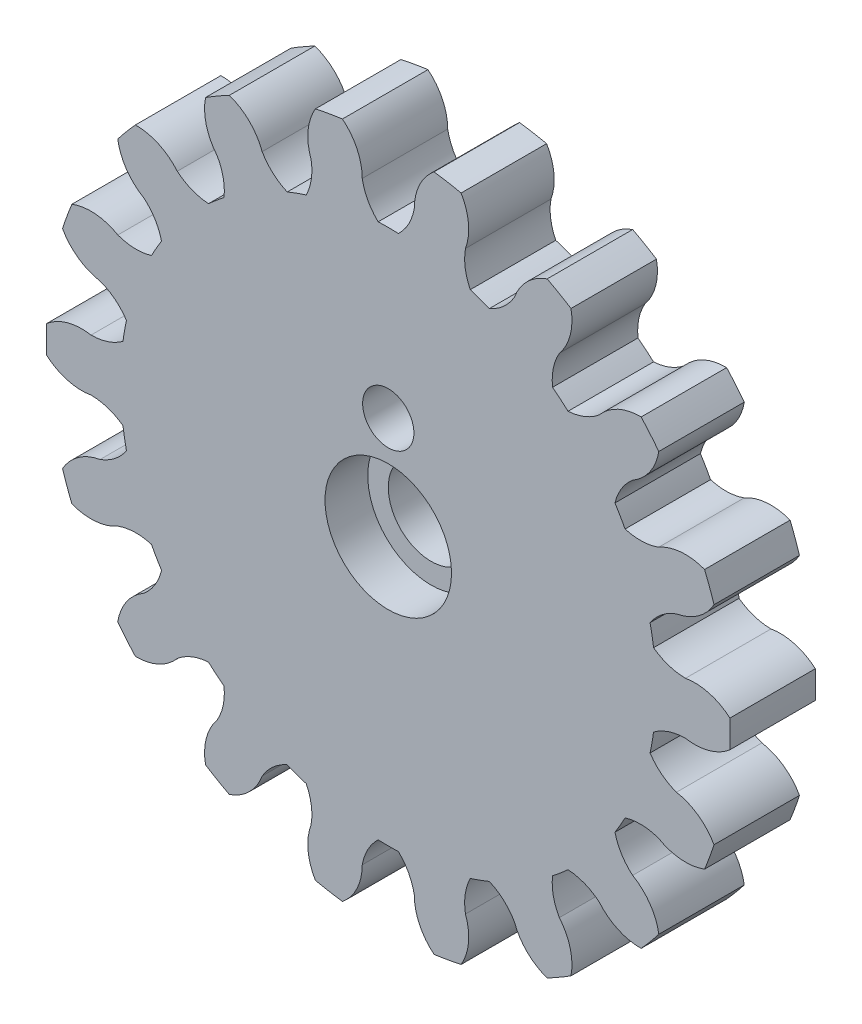
from build123d import *

# Parameters (mm, degrees)
CROQUIS1_R              = 20
CROQUIS1_R_2            = 2.5
CROQUIS1_R_3            = 1.5
SALIENTE_EXTRUIR1_DEPTH = 5
CORTAR_EXTRUIR1_DEPTH   = 29.722813233
MATRIZC1_COUNT          = 18
CROQUIS3_R              = 3.7
CORTAR_EXTRUIR2_DEPTH   = 2.5
CROQUIS4_R              = 2.25
CORTAR_EXTRUIR3_DEPTH   = 2.5


with BuildPart() as part:
    # Croquis1 → Saliente-Extruir1 (new body)
    with BuildSketch(Plane.XY):
        Circle(CROQUIS1_R)
        Circle(CROQUIS1_R_2, mode=Mode.SUBTRACT)
        with Locations((0, 6)):
            Circle(CROQUIS1_R_3, mode=Mode.SUBTRACT)
    extrude(amount=SALIENTE_EXTRUIR1_DEPTH)

    # Croquis2 → Cortar-Extruir1 (cut, through all)
    with BuildSketch(Plane.XY.offset(5)):
        with BuildLine():
            ThreePointArc((2.678584333, 19.819818011), (0, 20), (-2.678584333, 19.819818011))
            ThreePointArc((-2.678584333, 19.819818011), (-1.82600889, 18.733131722), (-1.522223543, 17.385731841))
            ThreePointArc((-1.522223543, 17.385731841), (-1.19593308, 16.445057276), (-0.5915417, 15.653827117))
            ThreePointArc((-0.5915417, 15.653827117), (0, 15.665), (0.5915417, 15.653827117))
            ThreePointArc((0.5915417, 15.653827117), (1.19593308, 16.445057276), (1.522223543, 17.385731841))
            ThreePointArc((1.522223543, 17.385731841), (1.82600889, 18.733131722), (2.678584333, 19.819818011))
        make_face()
    cortar_extruir1 = extrude(amount=-CORTAR_EXTRUIR1_DEPTH, mode=Mode.SUBTRACT)

    # MatrizC1: Cortar-Extruir1 ×18 about axis
    matrizc1_axis = Axis((0, 0, 0), (0, 0, 1))
    for i in range(1, MATRIZC1_COUNT):
        add(cortar_extruir1.rotate(matrizc1_axis, i * 360 / MATRIZC1_COUNT), mode=Mode.SUBTRACT)

    # Croquis3 → Cortar-Extruir2 (cut)
    with BuildSketch(Plane.XY.offset(5)):
        Circle(CROQUIS3_R)
    extrude(amount=-CORTAR_EXTRUIR2_DEPTH, mode=Mode.SUBTRACT)

    # Croquis4 → Cortar-Extruir3 (cut)
    with BuildSketch(Plane(origin=(0, 0, 0), x_dir=(-1, 0, 0), z_dir=(0, 0, -1))):
        with Locations((0, 6)):
            Circle(CROQUIS4_R)
    extrude(amount=-CORTAR_EXTRUIR3_DEPTH, mode=Mode.SUBTRACT)


solid = part.part
